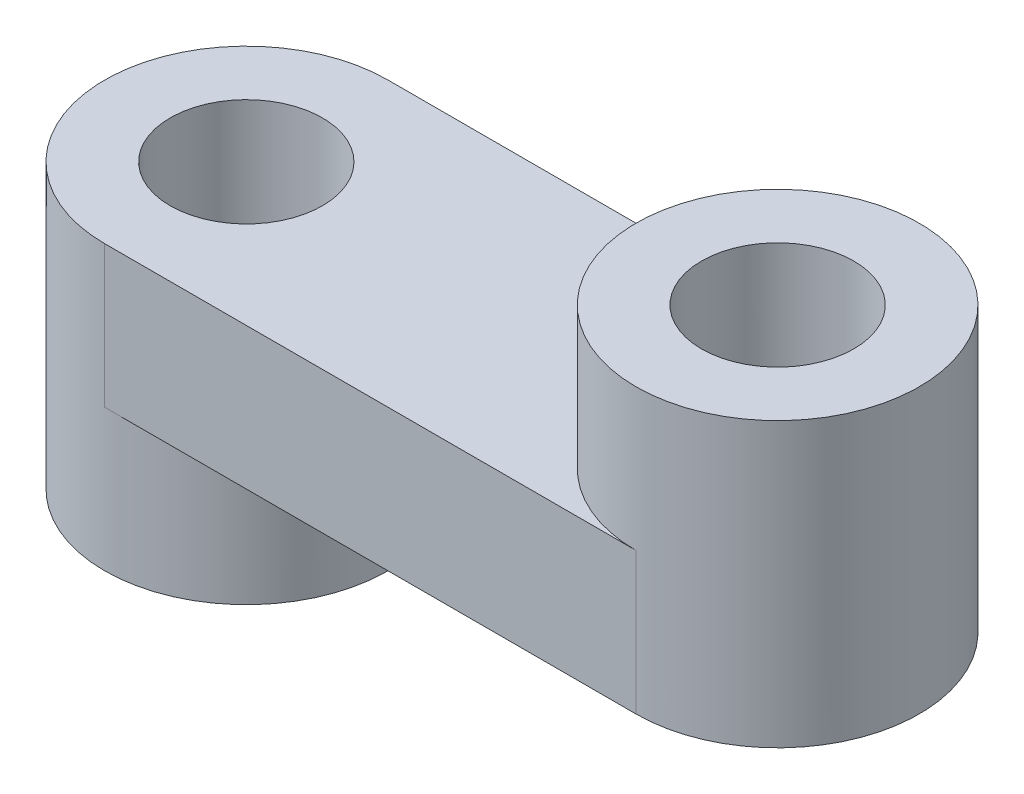
from build123d import *
from build123d.topology import SkipClean

# Parameters (mm, degrees)
SKETCH1_R           = 1.075
BOSS_EXTRUDE1_DEPTH = 6
CUT_EXTRUDE1_START  = -2
CUT_EXTRUDE1_DEPTH  = 2
CUT_EXTRUDE2_DEPTH  = 2


with BuildPart() as part:
    # Sketch1 → Boss-Extrude1 (new body)
    with BuildSketch(Plane(origin=(0, 0, 0), x_dir=(1, 0, 0), z_dir=(0, 1, 0))):
        with BuildLine():
            Line((0, 2), (7.5, 2))
            ThreePointArc((7.5, 2), (9.5, 0), (7.5, -2))
            Line((7.5, -2), (0, -2))
            ThreePointArc((0, -2), (-2, 0), (0, 2))
        make_face()
        with Locations(Location((0, 0, 0), (0, 0, 270))):
            Circle(SKETCH1_R, mode=Mode.SUBTRACT)
        with Locations(Location((7.5, 0, 0), (0, 0, 270))):
            Circle(SKETCH1_R, mode=Mode.SUBTRACT)
    extrude(amount=BOSS_EXTRUDE1_DEPTH)

    # Sketch2 → Cut-Extrude1 (cut)
    with BuildSketch(Plane(origin=(0, 6, 0), x_dir=(1, 0, 0), z_dir=(0, 1, 0)).offset(CUT_EXTRUDE1_START)):
        with BuildLine():
            Line((0, 2), (7.5, 2))
            ThreePointArc((7.5, 2), (5.5, 0), (7.5, -2))
            Line((7.5, -2), (0, -2))
            ThreePointArc((0, -2), (-2, 0), (0, 2))
        make_face()
    extrude(amount=CUT_EXTRUDE1_DEPTH, mode=Mode.SUBTRACT)

    # Sketch3 → Cut-Extrude2 (cut)
    with SkipClean():  # the faces are left unmerged after this step: merging them gives an invalid solid
        with BuildSketch(Plane.XZ):
            with BuildLine():
                Line((7.5, 2), (0, 2))
                ThreePointArc((0, 2), (2, 0), (0, -2))
                Line((0, -2), (7.5, -2))
                ThreePointArc((7.5, -2), (9.5, 0), (7.5, 2))
            make_face()
        extrude(amount=-CUT_EXTRUDE2_DEPTH, mode=Mode.SUBTRACT)


solid = part.part
